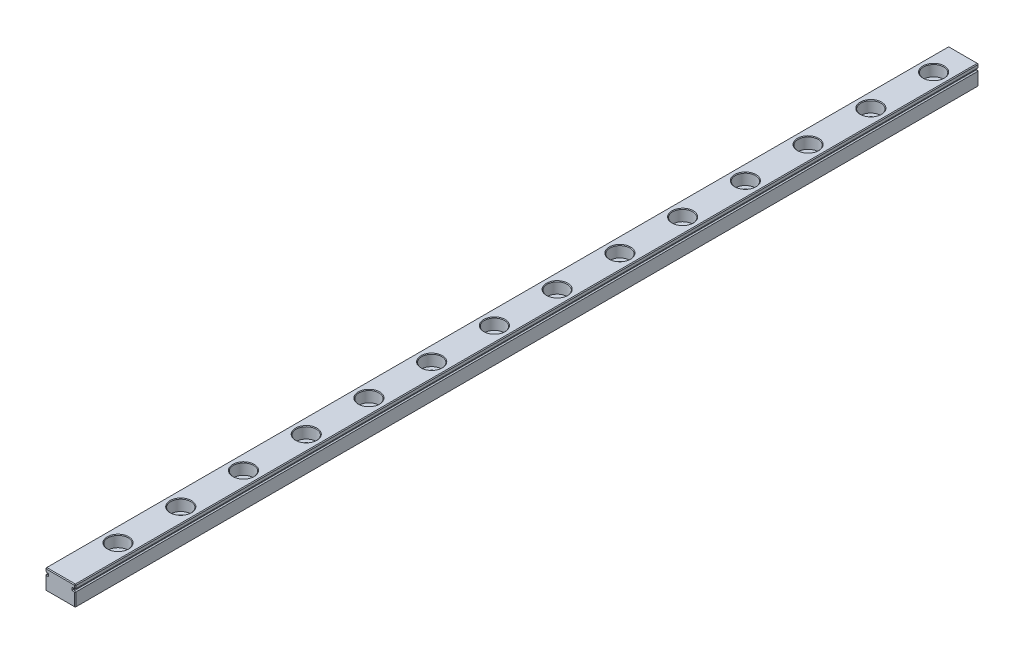
from build123d import *

# Parameters (mm, degrees)
BOSS_EXTRUDE1_DEPTH = 360
CHAMFER1_SIZE       = 0.3
LPATTERN1_COUNT     = 14
LPATTERN1_PITCH     = 25


with BuildPart() as part:
    # Sketch1 → Boss-Extrude1 (new body)
    with BuildSketch(Plane.XY):
        with BuildLine():
            Line((0, 8), (12, 8))
            Line((12, 8), (12, 6.75))
            Line((12, 6.75), (12, 6.559016994))
            ThreePointArc((12, 6.559016994), (11.706107374, 6.475528258), (11.5, 6.25))
            Line((11.5, 6.25), (11, 6.25))
            Line((11, 6.25), (11, 5.75))
            Line((11, 5.75), (11.5, 5.75))
            ThreePointArc((11.5, 5.75), (11.706107374, 5.524471742), (12, 5.440983006))
            Line((12, 5.440983006), (12, 5.25))
            Line((12, 5.25), (12, 0))
            Line((12, 0), (0, 0))
            Line((0, 0), (0, 5.25))
            Line((0, 5.25), (0, 5.440983006))
            ThreePointArc((0, 5.440983006), (0.293892626, 5.524471742), (0.5, 5.75))
            Line((0.5, 5.75), (1, 5.75))
            Line((1, 5.75), (1, 6.25))
            Line((1, 6.25), (0.5, 6.25))
            ThreePointArc((0.5, 6.25), (0.293892626, 6.475528258), (0, 6.559016994))
            Line((0, 6.559016994), (0, 6.75))
            Line((0, 6.75), (0, 8))
        make_face()
    extrude(amount=BOSS_EXTRUDE1_DEPTH)

    # Chamfer1
    chamfer1_edges = [part.edges().sort_by_distance(p)[0] for p in [
        (12, 2.720491503, 360),
        (11.706107374, 5.524471742, 360),
        (0, 2.720491503, 0),
        (0.293892626, 5.524471742, 0),
        (0.75, 5.75, 0),
        (1, 6, 0),
        (0.75, 6.25, 0),
        (11.25, 5.75, 360),
        (0.293892626, 6.475528258, 0),
        (0, 7.279508497, 0),
        (6, 8, 0),
        (12, 7.279508497, 0),
        (11.706107374, 6.475528258, 0),
        (11, 6, 360),
        (11.25, 6.25, 0),
        (11, 6, 0),
        (11.25, 5.75, 0),
        (11.706107374, 5.524471742, 0),
        (12, 2.720491503, 0),
        (6, 0, 0),
        (11.25, 6.25, 360),
        (11.706107374, 6.475528258, 360),
        (12, 7.279508497, 360),
        (0, 8, 180),
        (12, 8, 180),
        (12, 0, 180),
        (0, 0, 180),
        (6, 8, 360),
        (0, 2.720491503, 360),
        (0, 7.279508497, 360),
        (0.293892626, 6.475528258, 360),
        (0.75, 6.25, 360),
        (1, 6, 360),
        (0.75, 5.75, 360),
        (0.293892626, 5.524471742, 360),
        (6, 0, 360),
    ]]
    chamfer(chamfer1_edges, length=CHAMFER1_SIZE)

    # Sketch3 → CBORE for M5 Hex Head Bolt1 (revolve, cut)
    with BuildSketch(Plane(origin=(6, 8, 12), x_dir=(0, 0, 1), z_dir=(1, 0, 0))):
        Polygon((0, 0), (0, 8), (2.5, 8), (2.25, 7.75), (2.25, 4.5), (4, 4.5), (4, 0.25), (4.25, 0), align=None)
    cbore_for_m5_hex_head_bolt1 = revolve(axis=Axis((6, 14.35, 12), (0, -1, 0)), mode=Mode.SUBTRACT)

    # LPattern1: CBORE for M5 Hex Head Bolt1 ×14
    with Locations(*[(0, 0, i * LPATTERN1_PITCH) for i in range(1, LPATTERN1_COUNT)]):
        add(cbore_for_m5_hex_head_bolt1, mode=Mode.SUBTRACT)


solid = part.part
